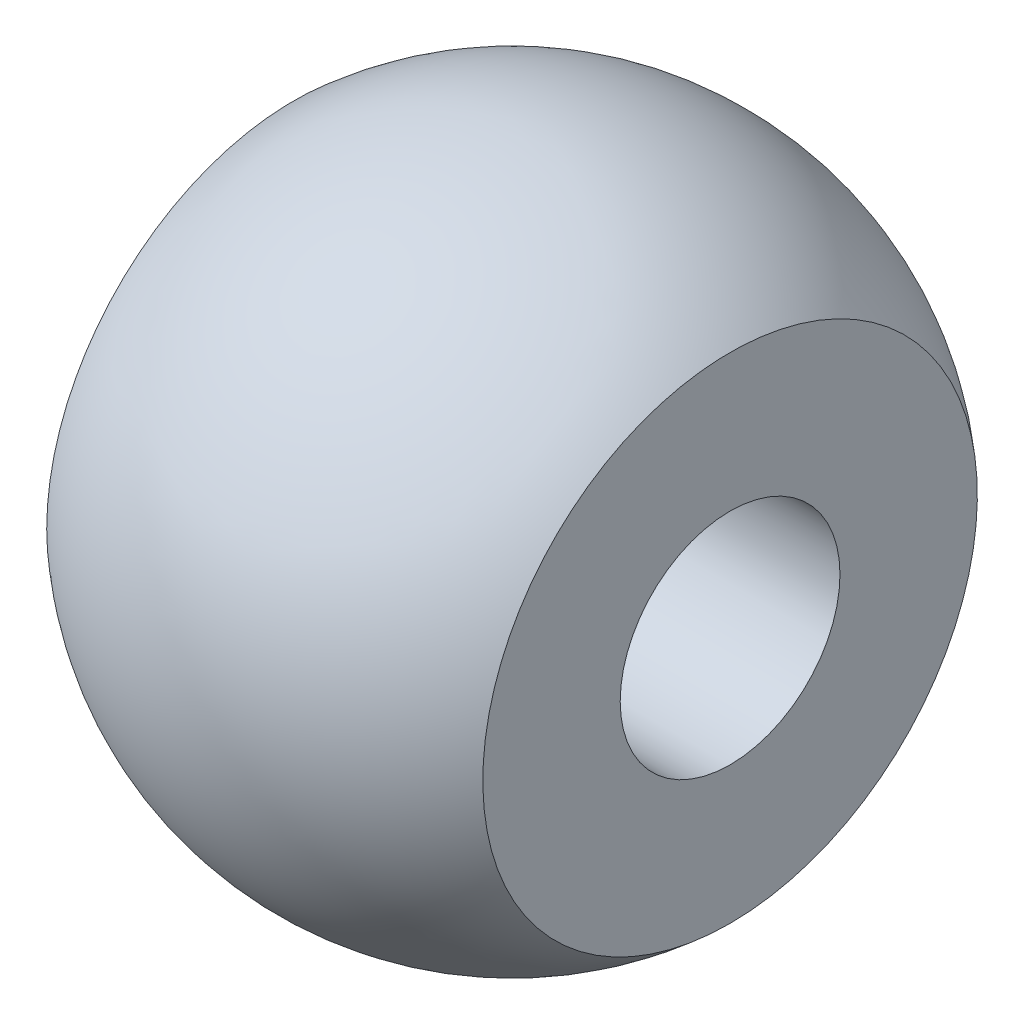
from build123d import *


with BuildPart() as part:
    # Sketch2 → Revolve1 (revolve)
    with BuildSketch(Plane.XY, mode=Mode.PRIVATE) as revolve1_sk:
        with BuildLine():
            Line((3.968626967, -2), (-1.468626967, -2))
            Line((-1.468626967, -2), (-2.968626967, -3.5))
            Line((-2.968626967, -3.5), (-3.968626967, -4.5))
            ThreePointArc((-3.968626967, -4.5), (0, -6), (3.968626967, -4.5))
            Line((3.968626967, -4.5), (3.968626967, -2))
        make_face()
    revolve(revolve1_sk.sketch.rotate(Axis((-10.332130717, 0, 0), (1, 0, 0)), 270), axis=Axis((-10.332130717, 0, 0), (1, 0, 0)))


solid = part.part
